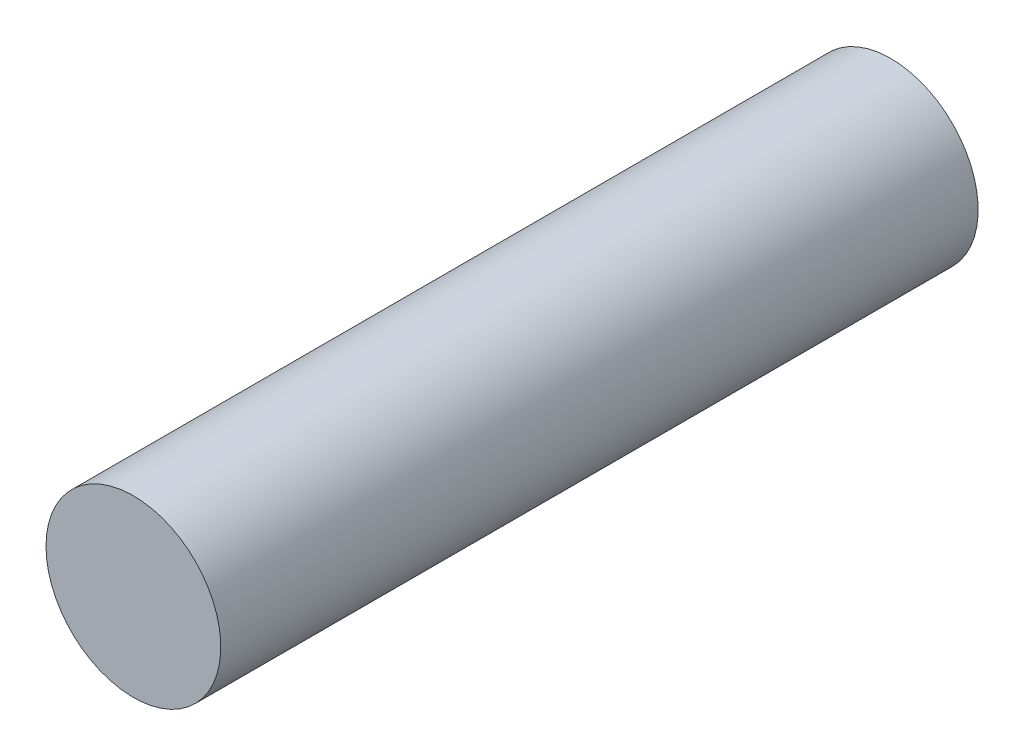
from build123d import *

# Parameters (mm, degrees)
SKETCH1_R           = 6
BOSS_EXTRUDE1_DEPTH = 52
SCALE1_SCALE        = 0.75
SCALE2_SCALE        = 0.5


with BuildPart() as part:
    # Sketch1 → Boss-Extrude1 (new body)
    with BuildSketch(Plane.XY):
        with Locations(Location((0, 0, 0), (0, 0, 180))):
            Circle(SKETCH1_R)
    extrude(amount=BOSS_EXTRUDE1_DEPTH)


with BuildPart() as part_1:
    # Scale1: scaled about (0, 0, 26)
    add(part.part.scale(SCALE1_SCALE).moved(Location((0, 0, 6.5))))


with BuildPart() as part_2:
    # Scale2: scaled about (0, 0, 26)
    add(part_1.part.scale(SCALE2_SCALE).moved(Location((0, 0, 13))))


solid = part_2.part
